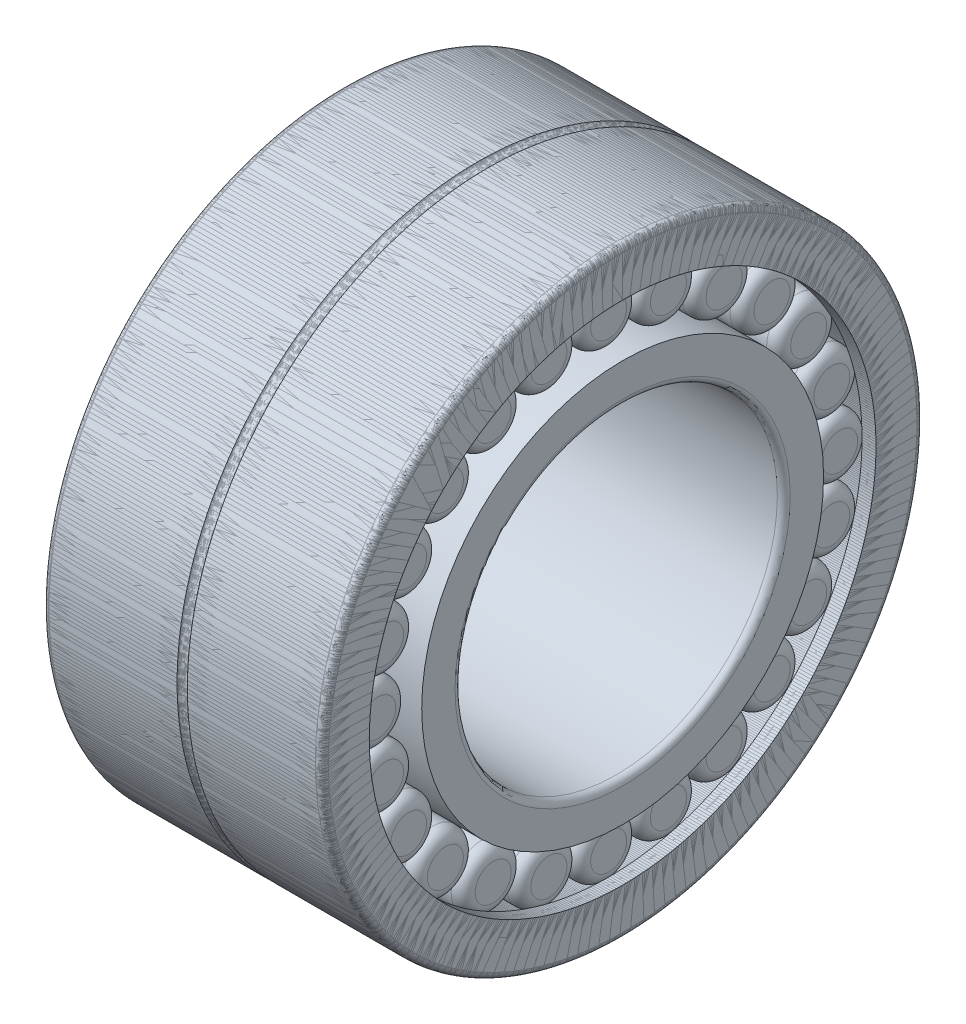
from build123d import *

# Parameters (mm, degrees)
CIRPATTERN1_COUNT = 24


with BuildPart() as part:
    # OutRacSke → OuterRace (revolve)
    with BuildSketch(Plane.XY):
        with BuildLine():
            Line((-5.85, 12.1475), (-5.85, 11.798125))
            Line((-5.85, 11.798125), (-6.5, 11.798125))
            Line((-6.5, 11.798125), (-6.5, 13.7))
            ThreePointArc((-6.5, 13.7), (-6.412132034, 13.912132034), (-6.2, 14))
            Line((-6.2, 14), (-0.24, 14))
            ThreePointArc((-0.24, 14), (0, 13.88), (0.24, 14))
            Line((0.24, 14), (6.2, 14))
            ThreePointArc((6.2, 14), (6.412132034, 13.912132034), (6.5, 13.7))
            Line((6.5, 13.7), (6.5, 11.798125))
            Line((6.5, 11.798125), (5.85, 11.798125))
            Line((5.85, 11.798125), (5.85, 12.1475))
            Line((5.85, 12.1475), (-5.85, 12.1475))
        make_face()
    revolve(axis=Axis((-7.9375, 0, 0), (1, 0, 0)))

    # RolDetSke → RollerDetailed (revolve)
    with BuildSketch(Plane.XY):
        with BuildLine():
            Line((-5.85, 11.5888), (-5.85, 10.75))
            Line((-5.85, 10.75), (5.85, 10.75))
            Line((5.85, 10.75), (5.85, 11.5888))
            ThreePointArc((5.85, 11.5888), (5.686214112, 11.984214112), (5.2908, 12.148))
            Line((5.2908, 12.148), (-5.2908, 12.148))
            ThreePointArc((-5.2908, 12.148), (-5.686214112, 11.984214112), (-5.85, 11.5888))
        make_face()
    revolve(axis=Axis((-28.575, 10.75, 0), (1, 0, 0)))


with BuildPart() as body_2:
    # InsRacSke → InnerRace (revolve)
    with BuildSketch(Plane.XY):
        with BuildLine():
            Line((-6.5, 9.3525), (-6.5, 7.8))
            ThreePointArc((-6.5, 7.8), (-6.412132034, 7.587867966), (-6.2, 7.5))
            Line((-6.2, 7.5), (6.2, 7.5))
            ThreePointArc((6.2, 7.5), (6.412132034, 7.587867966), (6.5, 7.8))
            Line((6.5, 7.8), (6.5, 9.3525))
            Line((6.5, 9.3525), (-6.5, 9.3525))
        make_face()
    revolve(axis=Axis((-7.9375, 0, 0), (1, 0, 0)))


with BuildPart() as cirpattern1_1:
    # CirPattern1: pattern copy
    add(part.part.rotate(Axis((-7.9375, 0, 0), (1, 0, 0)), 1 * 360 / CIRPATTERN1_COUNT))


with BuildPart() as cirpattern1_2:
    # CirPattern1: pattern copy
    add(part.part.rotate(Axis((-7.9375, 0, 0), (1, 0, 0)), 2 * 360 / CIRPATTERN1_COUNT))


with BuildPart() as cirpattern1_3:
    # CirPattern1: pattern copy
    add(part.part.rotate(Axis((-7.9375, 0, 0), (1, 0, 0)), 3 * 360 / CIRPATTERN1_COUNT))


with BuildPart() as cirpattern1_4:
    # CirPattern1: pattern copy
    add(part.part.rotate(Axis((-7.9375, 0, 0), (1, 0, 0)), 4 * 360 / CIRPATTERN1_COUNT))


with BuildPart() as cirpattern1_5:
    # CirPattern1: pattern copy
    add(part.part.rotate(Axis((-7.9375, 0, 0), (1, 0, 0)), 5 * 360 / CIRPATTERN1_COUNT))


with BuildPart() as cirpattern1_6:
    # CirPattern1: pattern copy
    add(part.part.rotate(Axis((-7.9375, 0, 0), (1, 0, 0)), 6 * 360 / CIRPATTERN1_COUNT))


with BuildPart() as cirpattern1_7:
    # CirPattern1: pattern copy
    add(part.part.rotate(Axis((-7.9375, 0, 0), (1, 0, 0)), 7 * 360 / CIRPATTERN1_COUNT))


with BuildPart() as cirpattern1_8:
    # CirPattern1: pattern copy
    add(part.part.rotate(Axis((-7.9375, 0, 0), (1, 0, 0)), 8 * 360 / CIRPATTERN1_COUNT))


with BuildPart() as cirpattern1_9:
    # CirPattern1: pattern copy
    add(part.part.rotate(Axis((-7.9375, 0, 0), (1, 0, 0)), 9 * 360 / CIRPATTERN1_COUNT))


with BuildPart() as cirpattern1_10:
    # CirPattern1: pattern copy
    add(part.part.rotate(Axis((-7.9375, 0, 0), (1, 0, 0)), 10 * 360 / CIRPATTERN1_COUNT))


with BuildPart() as cirpattern1_11:
    # CirPattern1: pattern copy
    add(part.part.rotate(Axis((-7.9375, 0, 0), (1, 0, 0)), 11 * 360 / CIRPATTERN1_COUNT))


with BuildPart() as cirpattern1_12:
    # CirPattern1: pattern copy
    add(part.part.rotate(Axis((-7.9375, 0, 0), (1, 0, 0)), 12 * 360 / CIRPATTERN1_COUNT))


with BuildPart() as cirpattern1_13:
    # CirPattern1: pattern copy
    add(part.part.rotate(Axis((-7.9375, 0, 0), (1, 0, 0)), 13 * 360 / CIRPATTERN1_COUNT))


with BuildPart() as cirpattern1_14:
    # CirPattern1: pattern copy
    add(part.part.rotate(Axis((-7.9375, 0, 0), (1, 0, 0)), 14 * 360 / CIRPATTERN1_COUNT))


with BuildPart() as cirpattern1_15:
    # CirPattern1: pattern copy
    add(part.part.rotate(Axis((-7.9375, 0, 0), (1, 0, 0)), 15 * 360 / CIRPATTERN1_COUNT))


with BuildPart() as cirpattern1_16:
    # CirPattern1: pattern copy
    add(part.part.rotate(Axis((-7.9375, 0, 0), (1, 0, 0)), 16 * 360 / CIRPATTERN1_COUNT))


with BuildPart() as cirpattern1_17:
    # CirPattern1: pattern copy
    add(part.part.rotate(Axis((-7.9375, 0, 0), (1, 0, 0)), 17 * 360 / CIRPATTERN1_COUNT))


with BuildPart() as cirpattern1_18:
    # CirPattern1: pattern copy
    add(part.part.rotate(Axis((-7.9375, 0, 0), (1, 0, 0)), 18 * 360 / CIRPATTERN1_COUNT))


with BuildPart() as cirpattern1_19:
    # CirPattern1: pattern copy
    add(part.part.rotate(Axis((-7.9375, 0, 0), (1, 0, 0)), 19 * 360 / CIRPATTERN1_COUNT))


with BuildPart() as cirpattern1_20:
    # CirPattern1: pattern copy
    add(part.part.rotate(Axis((-7.9375, 0, 0), (1, 0, 0)), 20 * 360 / CIRPATTERN1_COUNT))


with BuildPart() as cirpattern1_21:
    # CirPattern1: pattern copy
    add(part.part.rotate(Axis((-7.9375, 0, 0), (1, 0, 0)), 21 * 360 / CIRPATTERN1_COUNT))


with BuildPart() as cirpattern1_22:
    # CirPattern1: pattern copy
    add(part.part.rotate(Axis((-7.9375, 0, 0), (1, 0, 0)), 22 * 360 / CIRPATTERN1_COUNT))


with BuildPart() as cirpattern1_23:
    # CirPattern1: pattern copy
    add(part.part.rotate(Axis((-7.9375, 0, 0), (1, 0, 0)), 23 * 360 / CIRPATTERN1_COUNT))


solid = Compound([part.part, body_2.part, cirpattern1_1.part, cirpattern1_2.part, cirpattern1_3.part, cirpattern1_4.part, cirpattern1_5.part, cirpattern1_6.part, cirpattern1_7.part, cirpattern1_8.part, cirpattern1_9.part, cirpattern1_10.part, cirpattern1_11.part, cirpattern1_12.part, cirpattern1_13.part, cirpattern1_14.part, cirpattern1_15.part, cirpattern1_16.part, cirpattern1_17.part, cirpattern1_18.part, cirpattern1_19.part, cirpattern1_20.part, cirpattern1_21.part, cirpattern1_22.part, cirpattern1_23.part])
